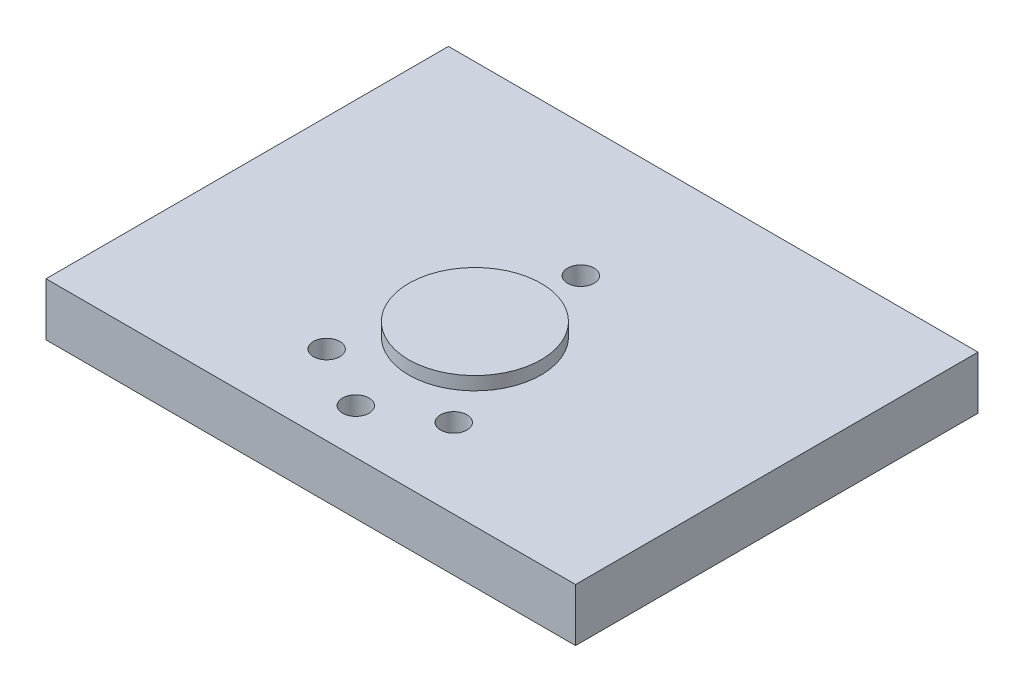
from build123d import *

# Parameters (mm, degrees)
SKETCH1_W                   = 127
SKETCH1_H                   = 96.52
BOSS_EXTRUDE1_DEPTH         = 15.875
SKETCH2_W                   = 127
SKETCH2_H                   = 96.52
SKETCH2_R                   = 15.875
CUT_EXTRUDE1_DEPTH          = 3.175
F_1_4_0_25_DIAMETER_HOLE1_D = 6.35


with BuildPart() as part:
    # Sketch1 → Boss-Extrude1 (new body)
    with BuildSketch(Plane(origin=(0, 0, 0), x_dir=(1, 0, 0), z_dir=(0, 1, 0))):
        Rectangle(SKETCH1_W, SKETCH1_H)
    extrude(amount=BOSS_EXTRUDE1_DEPTH)

    # Sketch2 → Cut-Extrude1 (cut)
    with BuildSketch(Plane(origin=(0, 15.875, 0), x_dir=(1, 0, 0), z_dir=(0, 1, 0))):
        Rectangle(SKETCH2_W, SKETCH2_H)
        with Locations(Location((0, -8.89, 0), (0, 0, 270))):
            Circle(SKETCH2_R, mode=Mode.SUBTRACT)
    extrude(amount=-CUT_EXTRUDE1_DEPTH, mode=Mode.SUBTRACT)

    # 1/4 (0.25) Diameter Hole1 (through all)
    with Locations(Plane(origin=(0, 12.7, 0), x_dir=(1, 0, 0), z_dir=(0, 1, 0))):
        with Locations((15.24, -29.21), (0, -37.465), (0, 16.51), (-15.24, -29.21)):
            Hole(F_1_4_0_25_DIAMETER_HOLE1_D / 2)


solid = part.part
